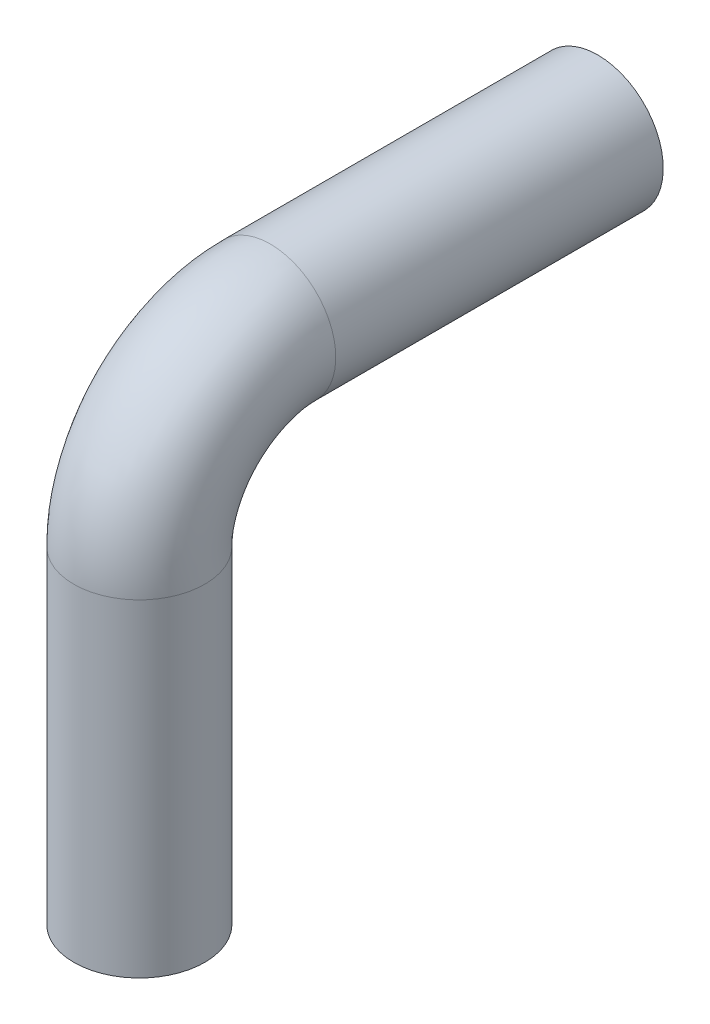
from build123d import *

# Parameters (mm, degrees)
SKETCH1_R = 12.7


with BuildPart() as part:
    # Sweep1: sweep along a path in Sketch2
    with BuildLine(Plane(origin=(0, 0, 0), x_dir=(0, 0, -1), z_dir=(1, 0, 0))) as sweep1_path:
        Line((0, 0), (0, 63.5))
        ThreePointArc((0, 63.5), (7.439487758, 81.460512242), (25.4, 88.9))
        Line((25.4, 88.9), (88.9, 88.9))
    # Sketch1 → Sweep1 (sweep)
    with BuildSketch(Plane(origin=(0, 0, 0), x_dir=(1, 0, 0), z_dir=(0, 1, 0))):
        Circle(SKETCH1_R)
    sweep(path=sweep1_path.line)


solid = part.part
